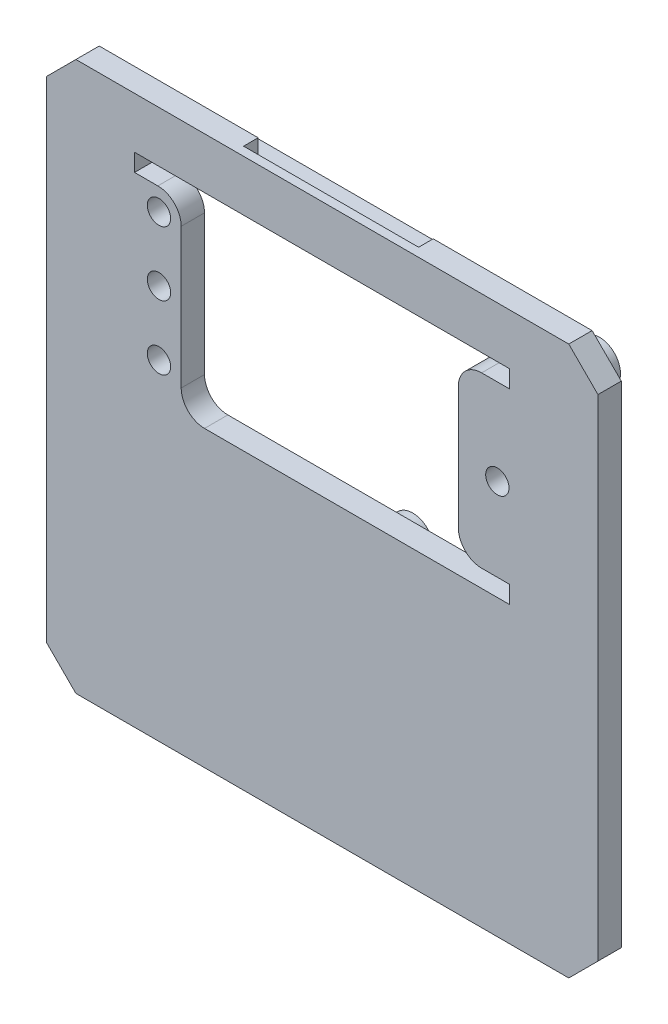
from build123d import *

# Parameters (mm, degrees)
SKETCH1_W               = 59.992800004
SKETCH1_H               = 59.7535
BOSS_EXTRUDE1_DEPTH     = 2.54
SKETCH2_R               = 2.286000002
BOSS_EXTRUDE2_DEPTH     = 4.7625
SKETCH3_R               = 1.270000002
CUT_EXTRUDE1_DEPTH      = 3.175
CUT_EXTRUDE2_REACH      = 44.962
SKETCH4_W               = 30.1625
SKETCH4_H               = 22.225
CUT_EXTRUDE3_REACH      = 44.962
SKETCH5_R               = 1.269999998
SKETCH6_W               = 38.1
SKETCH6_H               = 1.5875
BOSS_EXTRUDE3_DEPTH     = 3.175
CHAMFER1_SIZE           = 3.175
CUT_EXTRUDE4_DEPTH      = 43.603821541
CUT_EXTRUDE4_DEPTH_BACK = 43.603821541
CUT_EXTRUDE5_DEPTH      = 9.525
CUT_EXTRUDE5_DEPTH_BACK = 9.525
SKETCH8_R               = 1.5875
SKETCH9_W               = 5.588
SKETCH9_H               = 1.905
SKETCH9_W_2             = 5.08
CUT_EXTRUDE6_DEPTH      = 43.96196818
FILLET1_R               = 2.54


with BuildPart() as part:
    # Sketch1 → Boss-Extrude1 (new body)
    with BuildSketch(Plane.XY):
        Rectangle(SKETCH1_W, SKETCH1_H)
    extrude(amount=BOSS_EXTRUDE1_DEPTH)

    # Sketch2 → Boss-Extrude2 (add)
    with BuildSketch(Plane(origin=(0, 0, 0), x_dir=(-1, 0, 0), z_dir=(0, 0, -1))):
        with Locations(Location((-22.859000002, 22.60425, 0), (0, 0, 180))):
            Circle(SKETCH2_R)
        with Locations(Location((22.860999998, 21.93925, 0), (0, 0, 180))):
            Circle(SKETCH2_R)
        with Locations(Location((22.860999998, 4.15925, 0), (0, 0, 180))):
            Circle(SKETCH2_R)
        with Locations(Location((-22.859000002, 3.49425, 0), (0, 0, 180))):
            Circle(SKETCH2_R)
        with Locations(Location((-22.859000002, -4.12575, 0), (0, 0, 180))):
            Circle(SKETCH2_R)
        with Locations(Location((-2.539000002, -4.12575, 0), (0, 0, 180))):
            Circle(SKETCH2_R)
        with Locations(Location((-22.859000002, -21.90575, 0), (0, 0, 180))):
            Circle(SKETCH2_R)
        with Locations(Location((-2.539000002, -21.90575, 0), (0, 0, 180))):
            Circle(SKETCH2_R)
    extrude(amount=BOSS_EXTRUDE2_DEPTH)

    # Sketch3 → Cut-Extrude1 (cut)
    with BuildSketch(Plane(origin=(0, 0, -4.7625), x_dir=(-1, 0, 0), z_dir=(0, 0, -1))):
        with Locations((-22.859000002, 22.60425)):
            Circle(SKETCH3_R)
        with Locations((22.860999998, 21.93925)):
            Circle(SKETCH3_R)
        with Locations((22.860999998, 4.15925)):
            Circle(SKETCH3_R)
        with Locations((-2.539000002, -4.12575)):
            Circle(SKETCH3_R)
        with Locations((-22.859000002, 3.49425)):
            Circle(SKETCH3_R)
        with Locations((-22.859000002, -4.12575)):
            Circle(SKETCH3_R)
        with Locations((-22.859000002, -21.90575)):
            Circle(SKETCH3_R)
        with Locations((-2.539000002, -21.90575)):
            Circle(SKETCH3_R)
    extrude(amount=-CUT_EXTRUDE1_DEPTH, mode=Mode.SUBTRACT)

    # Sketch4 → Cut-Extrude2 (cut, up to next)
    with BuildSketch(Plane.XY.offset(2.54), mode=Mode.PRIVATE) as cut_extrude2_sk1:
        with Locations((-0.280399998, 13.21435)):
            Rectangle(SKETCH4_W, SKETCH4_H)
    cut_extrude2_tool1 = extrude(cut_extrude2_sk1.sketch, amount=-CUT_EXTRUDE2_REACH, mode=Mode.PRIVATE) & part.part
    add(cut_extrude2_tool1.solids().sort_by_distance((-0.2804, 13.21435, 2.54))[0], mode=Mode.SUBTRACT)

    # Sketch5 → Cut-Extrude3 (cut, up to next)
    with BuildSketch(Plane.XY.offset(2.54), mode=Mode.PRIVATE) as cut_extrude3_sk1:
        with Locations((-17.780999998, 20.03425)):
            Circle(SKETCH5_R)
    cut_extrude3_tool1 = extrude(cut_extrude3_sk1.sketch, amount=-CUT_EXTRUDE3_REACH, mode=Mode.PRIVATE) & part.part
    # Sketch5 → Cut-Extrude3 (cut, up to next)
    with BuildSketch(Plane.XY.offset(2.54), mode=Mode.PRIVATE) as cut_extrude3_sk2:
        with Locations((-17.780999998, 13.04925)):
            Circle(SKETCH5_R)
    cut_extrude3_tool2 = extrude(cut_extrude3_sk2.sketch, amount=-CUT_EXTRUDE3_REACH, mode=Mode.PRIVATE) & part.part
    # Sketch5 → Cut-Extrude3 (cut, up to next)
    with BuildSketch(Plane.XY.offset(2.54), mode=Mode.PRIVATE) as cut_extrude3_sk3:
        with Locations((-17.780999998, 6.06425)):
            Circle(SKETCH5_R)
    cut_extrude3_tool3 = extrude(cut_extrude3_sk3.sketch, amount=-CUT_EXTRUDE3_REACH, mode=Mode.PRIVATE) & part.part
    # Sketch5 → Cut-Extrude3 (cut, up to next)
    with BuildSketch(Plane.XY.offset(2.54), mode=Mode.PRIVATE) as cut_extrude3_sk4:
        with Locations((19.049000002, 13.04925)):
            Circle(SKETCH5_R)
    cut_extrude3_tool4 = extrude(cut_extrude3_sk4.sketch, amount=-CUT_EXTRUDE3_REACH, mode=Mode.PRIVATE) & part.part
    add(cut_extrude3_tool1.solids().sort_by_distance((-17.781, 20.03425, 2.54))[0], mode=Mode.SUBTRACT)
    add(cut_extrude3_tool2.solids().sort_by_distance((-17.781, 13.04925, 2.54))[0], mode=Mode.SUBTRACT)
    add(cut_extrude3_tool3.solids().sort_by_distance((-17.781, 6.06425, 2.54))[0], mode=Mode.SUBTRACT)
    add(cut_extrude3_tool4.solids().sort_by_distance((19.049, 13.04925, 2.54))[0], mode=Mode.SUBTRACT)

    # Sketch6 → Boss-Extrude3 (add)
    with BuildSketch(Plane(origin=(0, 0, 0), x_dir=(-1, 0, 0), z_dir=(0, 0, -1))):
        with Locations((0, 25.81275)):
            Rectangle(SKETCH6_W, SKETCH6_H)
        with Locations((0, -25.81275)):
            Rectangle(SKETCH6_W, SKETCH6_H)
    extrude(amount=BOSS_EXTRUDE3_DEPTH)

    # Chamfer1
    chamfer1_edges = [part.edges().sort_by_distance(p)[0] for p in [
        (29.996400002, -29.87675, 1.27),
        (-29.996400002, -29.87675, 1.27),
        (-29.996400002, 29.87675, 1.27),
        (29.996400002, 29.87675, 1.27),
    ]]
    chamfer(chamfer1_edges, length=CHAMFER1_SIZE)

    # Sketch7 → Cut-Extrude4 (cut, two sides: drawn at the far end of the back side and taken through both)
    with BuildSketch(Plane(origin=(0, 0, 0), x_dir=(0, 0, -1), z_dir=(1, 0, 0)).offset(-CUT_EXTRUDE4_DEPTH_BACK)):
        with BuildLine():
            Line((0, 26.6065), (0.5, 26.6065))
            ThreePointArc((0.5, 26.6065), (0.25, 26.3565), (0, 26.6065))
        make_face()
        with BuildLine():
            Line((0, -26.6065), (0.5, -26.6065))
            ThreePointArc((0.5, -26.6065), (0.25, -26.3565), (0, -26.6065))
        make_face()
    extrude(amount=CUT_EXTRUDE4_DEPTH + CUT_EXTRUDE4_DEPTH_BACK, mode=Mode.SUBTRACT)

    # Sketch8 → Cut-Extrude5 (cut, two sides: drawn at the far end of the back side and taken through both)
    with BuildSketch(Plane(origin=(0, 0, 0), x_dir=(0, 0, -1), z_dir=(1, 0, 0)).offset(-CUT_EXTRUDE5_DEPTH_BACK)):
        with Locations((0, 29.87675)):
            Circle(SKETCH8_R)
        with Locations((0, -29.87675)):
            Circle(SKETCH8_R)
    extrude(amount=CUT_EXTRUDE5_DEPTH + CUT_EXTRUDE5_DEPTH_BACK, mode=Mode.SUBTRACT)

    # Sketch9 → Cut-Extrude6 (cut, through all)
    with BuildSketch(Plane.XY.offset(2.54)):
        with Locations((17.594850002, 3.05435)):
            Rectangle(SKETCH9_W, SKETCH9_H)
        with Locations((-17.901649998, 23.37435)):
            Rectangle(SKETCH9_W_2, SKETCH9_H)
        with Locations((17.594850002, 23.37435)):
            Rectangle(SKETCH9_W, SKETCH9_H)
    extrude(amount=-CUT_EXTRUDE6_DEPTH, mode=Mode.SUBTRACT)

    # Fillet1
    fillet1_edges = [part.edges().sort_by_distance(p)[0] for p in [
        (14.800850002, 4.00685, 1.27),
        (-15.361649998, 22.42185, 1.27),
        (14.800850002, 22.42185, 1.27),
        (-15.361649998, 2.10185, 1.27),
    ]]
    fillet(fillet1_edges, radius=FILLET1_R)


solid = part.part
